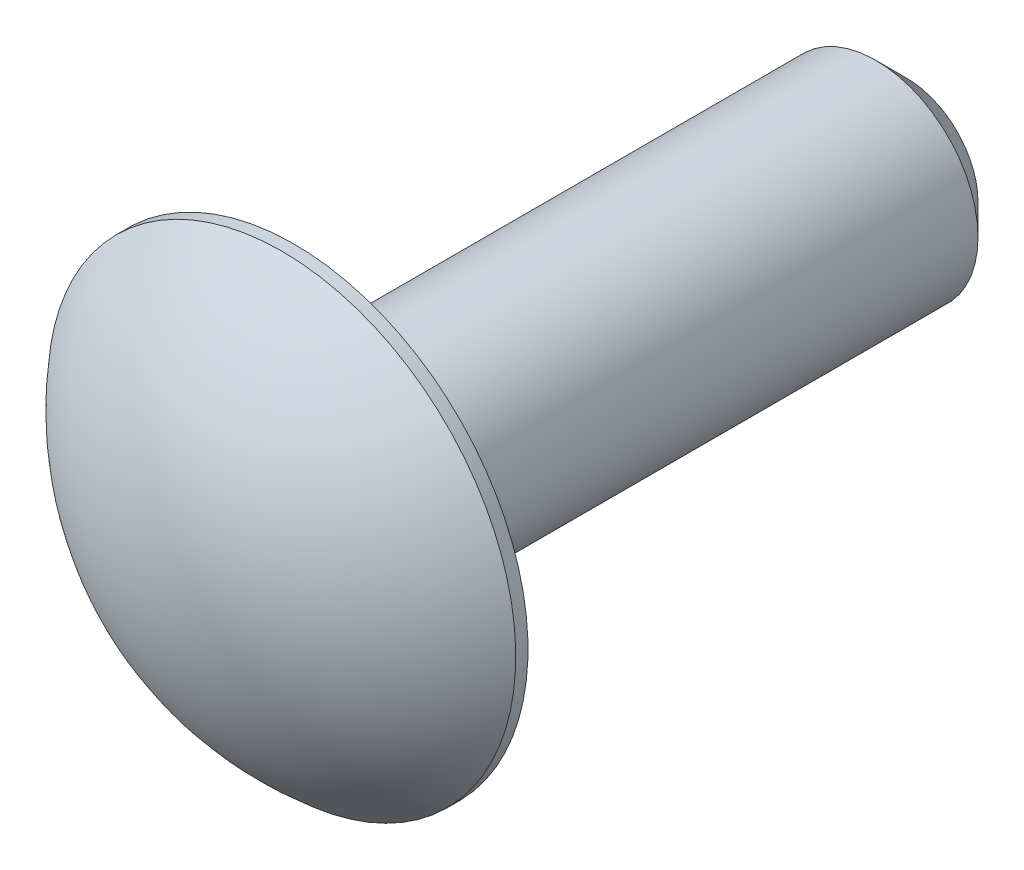
from build123d import *

# Parameters (mm, degrees)
SKETCH1_R            = 7.2771
EXTRUDE3_DEPTH       = 3.81
SKETCH4_W            = 19.05
SKETCH4_H            = 3.175
CHAMFER2_SIZE        = 0.9525
EXTRUDE13_REACH      = 23.652
EXTRUDE13_END_RADIUS = 9.436311667
SKETCH26_R           = 0.5461


with BuildPart() as part:
    # Sketch1 → Extrude3 (new body)
    with BuildSketch(Plane.XY):
        Circle(SKETCH1_R)
    extrude(amount=EXTRUDE3_DEPTH)

    # Sketch11 → Cut-Revolve3 (revolve, cut)
    with BuildSketch(Plane(origin=(0, 0, 0), x_dir=(0, 0, -1), z_dir=(1, 0, 0))):
        with BuildLine():
            Line((-4.064, 8.73252), (0, 8.73252))
            Line((0, 8.73252), (0, 7.2771))
            Line((0, 7.2771), (-0.381, 7.2771))
            ThreePointArc((-0.381, 7.2771), (-2.909812836, 4.022257619), (-3.81, 0))
            Line((-3.81, 0), (-4.064, 0))
            Line((-4.064, 0), (-4.064, 8.73252))
        make_face()
    revolve(axis=Axis((0, 0, 0), (0, 0, 1)), mode=Mode.SUBTRACT)



with BuildPart() as body_2:
    # Sketch4 → Revolve1 (revolve)
    with BuildSketch(Plane(origin=(0, 0, 0), x_dir=(0, 0, -1), z_dir=(1, 0, 0))):
        with Locations((9.525, 1.5875)):
            Rectangle(SKETCH4_W, SKETCH4_H)
    revolve(axis=Axis((0, 0, 0), (0, 0, -1)))

    # Chamfer2
    chamfer2_edges = [body_2.edges().sort_by_distance(p)[0] for p in [
        (0, -3.175, -19.05),
    ]]
    chamfer(chamfer2_edges, length=CHAMFER2_SIZE)


with BuildPart() as part_1:
    add(part.part)

    add(body_2.part)  # Extrude13 merges body 2
    # Extrude13: up to this sphere (the profile starts inside it)
    extrude13_end = Location((0, 0, -5.626311667)) * Sphere(EXTRUDE13_END_RADIUS, mode=Mode.PRIVATE)
    # Sketch26 → Extrude13 (add, up to the surface)
    with BuildSketch(Plane.XY, mode=Mode.PRIVATE) as extrude13_sk1:
        Circle(SKETCH26_R)
    extrude13_tool1 = extrude(extrude13_sk1.sketch, amount=EXTRUDE13_REACH, mode=Mode.PRIVATE) & extrude13_end
    add(extrude13_tool1.solids().sort_by_distance((0, 0, 0))[0])


solid = part_1.part
